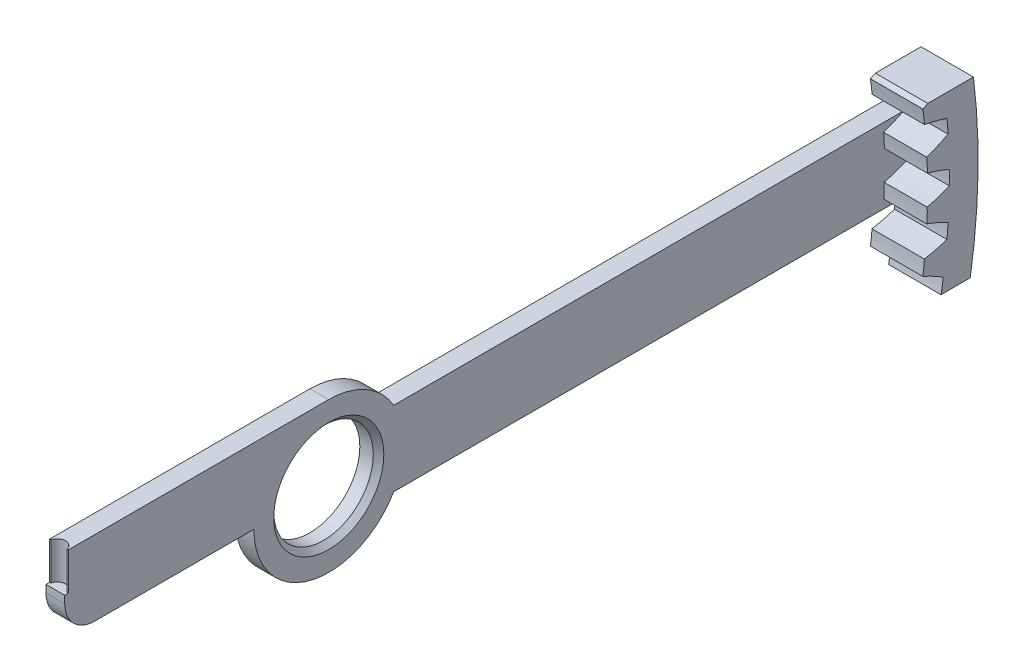
from build123d import *

# Parameters (mm, degrees)
SKETCH_1_R          = 6.65
EXTRUDE_1_DEPTH     = 1.25
EXTRUDE_START       = 7
EXTRUDE_2_DEPTH     = 7
SKETCH_3_R          = 1.1
CUT_EXTRUDE_1_DEPTH = 5
CHAMFER_1_SIZE      = 0.7


with BuildPart() as part:
    # Эскиз1 → Бобышка-Вытянуть1 (new, symmetric)
    with BuildSketch(Plane(origin=(0, 0, 0), x_dir=(0, 0, -1), z_dir=(1, 0, 0))):
        with BuildLine():
            Line((-31.25, 0), (-10, 0))
            ThreePointArc((-10, 0), (-2.588190451, -9.659258263), (8.660254038, -5))
            Line((8.660254038, -5), (76.721847542, -5))
            ThreePointArc((76.721847542, -5), (75.425886146, -4.389181279), (74.09117429, -3.868451302))
            ThreePointArc((74.09117429, -3.868451302), (74.147561595, -2.912548148), (74.149130868, -1.954984622))
            ThreePointArc((74.149130868, -1.954984622), (75.638846987, -1.51744657), (77.087831178, -0.959648686))
            ThreePointArc((77.087831178, -0.959648686), (77.109856091, -0.006099484), (77.083941958, 0.947351948))
            ThreePointArc((77.083941958, 0.947351948), (75.643750299, 1.505844774), (74.166291118, 1.956600379))
            ThreePointArc((74.166291118, 1.956600379), (74.147505302, 2.913980899), (74.073940169, 3.8687157))
            ThreePointArc((74.073940169, 3.8687157), (75.433826566, 4.383081961), (76.750365892, 5))
            Line((76.750365892, 5), (8.660254038, 5))
            ThreePointArc((8.660254038, 5), (5, 8.660254038), (0, 10))
            Line((0, 10), (-34.75, 10))
            Line((-34.75, 10), (-34.75, 5))
            Line((-34.75, 5), (-35.25, 5))
            Line((-35.25, 5), (-35.25, 4))
            ThreePointArc((-35.25, 4), (-34.078427125, 1.171572875), (-31.25, 0))
        make_face()
        Circle(SKETCH_1_R, mode=Mode.SUBTRACT)
    extrude(amount=EXTRUDE_1_DEPTH, both=True)

    # Эскиз1<5> → Бобышка-Вытянуть2 (add)
    with BuildSketch(Plane(origin=(0, 0, 0), x_dir=(0, 0, -1), z_dir=(1, 0, 0)).offset(EXTRUDE_START)):
        with BuildLine():
            Line((73.559260736, 9.685830974), (74.227172899, 10))
            Line((74.227172899, 10), (80.32185029, 10))
            ThreePointArc((80.32185029, 10), (80.927765714, -1.515378033), (79.891173693, -13))
            Line((79.891173693, -13), (75.988629927, -13.007027449))
            ThreePointArc((75.988629927, -13.007027449), (76.159551637, -12.068663477), (76.283109214, -11.12289675))
            ThreePointArc((76.283109214, -11.12289675), (74.948016231, -10.345984286), (73.559260736, -9.669652694))
            ThreePointArc((73.559260736, -9.669652694), (73.690473514, -8.721120367), (73.767167518, -7.766631814))
            ThreePointArc((73.767167518, -7.766631814), (75.28662018, -7.447324325), (76.774901953, -7.004931935))
            ThreePointArc((76.774901953, -7.004931935), (76.871673579, -6.056050262), (76.920646267, -5.103504803))
            ThreePointArc((76.920646267, -5.103504803), (75.528713081, -4.433737489), (74.09117429, -3.868451302))
            ThreePointArc((74.09117429, -3.868451302), (74.147561595, -2.912548148), (74.149130868, -1.954984622))
            ThreePointArc((74.149130868, -1.954984622), (75.638846987, -1.51744657), (77.087831178, -0.959648686))
            ThreePointArc((77.087831178, -0.959648686), (77.109856091, -0.006099484), (77.083941958, 0.947351948))
            ThreePointArc((77.083941958, 0.947351948), (75.643750299, 1.505844774), (74.166291118, 1.956600379))
            ThreePointArc((74.166291118, 1.956600379), (74.147505302, 2.913980899), (74.073940169, 3.8687157))
            ThreePointArc((74.073940169, 3.8687157), (75.524735151, 4.421786748), (76.925488289, 5.091551117))
            ThreePointArc((76.925488289, 5.091551117), (76.872630699, 6.043888899), (76.771989513, 6.992367959))
            ThreePointArc((76.771989513, 6.992367959), (75.292418643, 7.436143003), (73.784148097, 7.769588967))
            ThreePointArc((73.784148097, 7.769588967), (73.691130431, 8.729989779), (73.559260736, 9.685830974))
        make_face()
    extrude(amount=-EXTRUDE_2_DEPTH)

    # Эскиз3 → Вырез-Вытянуть1 (cut)
    with BuildSketch(Plane(origin=(0, 10, 0), x_dir=(1, 0, 0), z_dir=(0, 1, 0))):
        with Locations((0, -35)):
            Circle(SKETCH_3_R)
    extrude(amount=-CUT_EXTRUDE_1_DEPTH, mode=Mode.SUBTRACT)

    # Фаска1
    chamfer_1_edges = [part.edges().sort_by_distance(p)[0] for p in [
        (1.25, 0, 6.65),
    ]]
    chamfer(chamfer_1_edges, length=CHAMFER_1_SIZE)


solid = part.part
